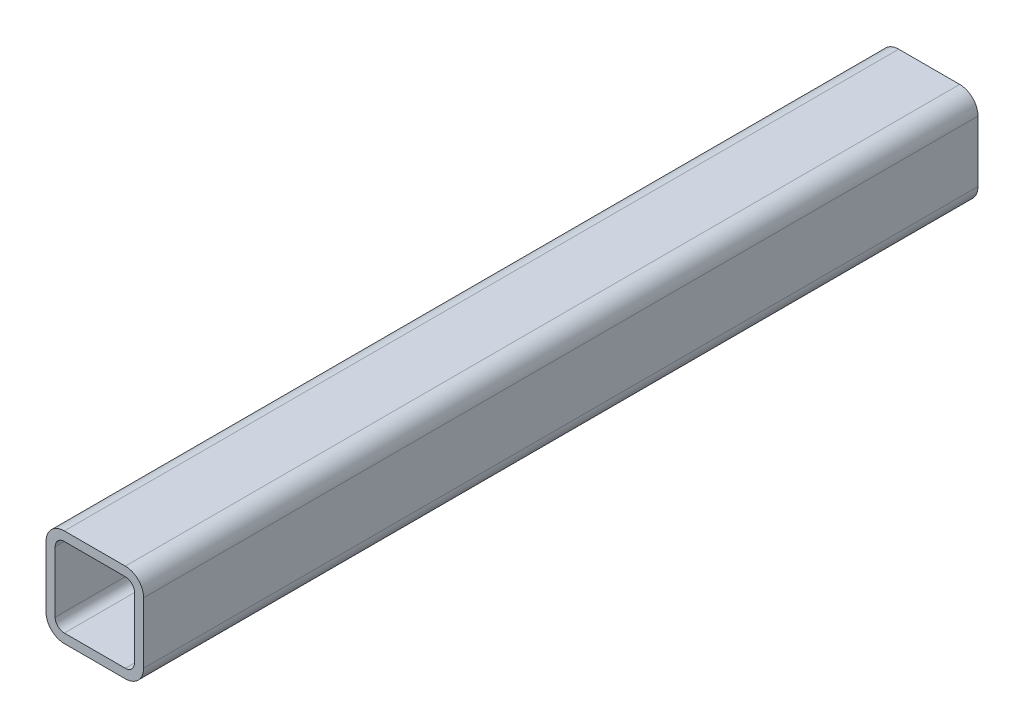
from build123d import *

# Parameters (mm, degrees)
DODANIE_WYCI_GNI_CIE1_DEPTH = 434.2


with BuildPart() as part:
    # Szkic1 → Dodanie-wyciągnięcie1 (new body)
    with BuildSketch(Plane.XY):
        with BuildLine():
            Line((9.53, 0), (41.27, 0))
            ThreePointArc((41.27, 0), (48.008727625, 2.791272375), (50.8, 9.53))
            Line((50.8, 9.53), (50.8, 41.27))
            ThreePointArc((50.8, 41.27), (48.008727625, 48.008727625), (41.27, 50.8))
            Line((41.27, 50.8), (9.53, 50.8))
            ThreePointArc((9.53, 50.8), (2.791272375, 48.008727625), (0, 41.27))
            Line((0, 41.27), (0, 9.53))
            ThreePointArc((0, 9.53), (2.791272375, 2.791272375), (9.53, 0))
        make_face()
        with BuildLine():
            Line((9.52, 46.04), (41.28, 46.04))
            ThreePointArc((41.28, 46.04), (44.645828278, 44.645828278), (46.04, 41.28))
            Line((46.04, 41.28), (46.04, 9.52))
            ThreePointArc((46.04, 9.52), (44.645828278, 6.154171722), (41.28, 4.76))
            Line((41.28, 4.76), (9.52, 4.76))
            ThreePointArc((9.52, 4.76), (6.154171722, 6.154171722), (4.76, 9.52))
            Line((4.76, 9.52), (4.76, 41.28))
            ThreePointArc((4.76, 41.28), (6.154171722, 44.645828278), (9.52, 46.04))
        make_face(mode=Mode.SUBTRACT)
    extrude(amount=DODANIE_WYCI_GNI_CIE1_DEPTH)


solid = part.part
